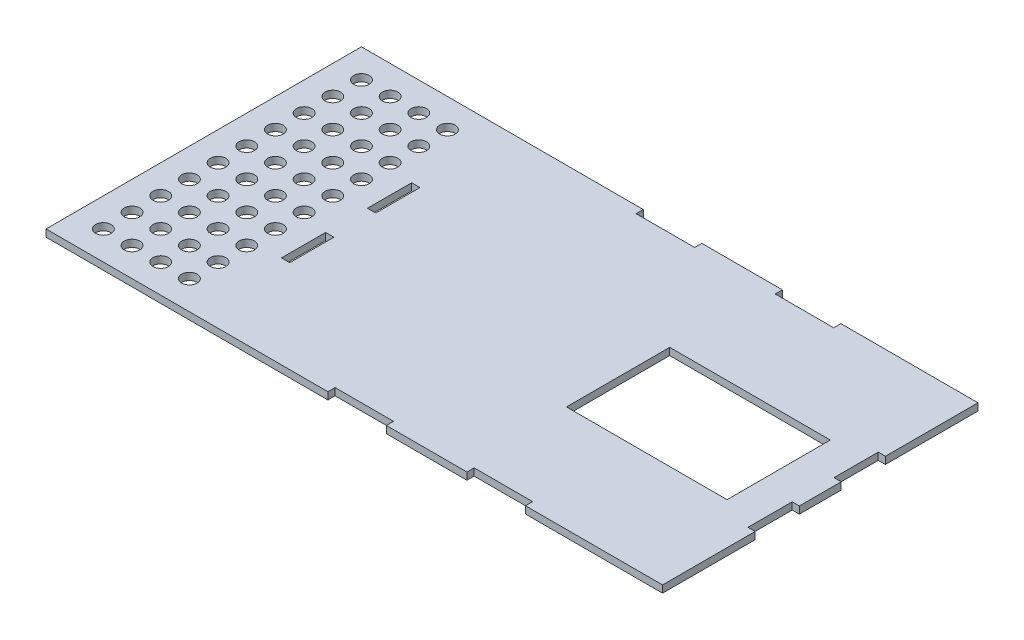
from build123d import *

# Parameters (mm, degrees)
SKETCH1_W           = 203.2
SKETCH1_H           = 133.35
BOSS_EXTRUDE1_DEPTH = 3.175
SKETCH3_W           = 35.687
SKETCH3_H           = 3.175
BOSS_EXTRUDE2_DEPTH = 3.175
SKETCH4_W           = 3.175
SKETCH4_H           = 18.542
BOSS_EXTRUDE3_DEPTH = 3.175
SKETCH5_W           = 63.5
SKETCH5_H           = 139.7
SKETCH5_R           = 3.429
BOSS_EXTRUDE4_DEPTH = 3.175
BOSS_EXTRUDE5_DEPTH = 3.175
SKETCH7_W           = 3.683
SKETCH7_H           = 19.558
CUT_EXTRUDE1_DEPTH  = 183.223979624
SKETCH8_W           = 71.12
SKETCH8_H           = 45.72
CUT_EXTRUDE4_DEPTH  = 183.223979624


with BuildPart() as part:
    # Sketch1 → Boss-Extrude1 (new body)
    with BuildSketch(Plane(origin=(0, 0, 0), x_dir=(1, 0, 0), z_dir=(0, 1, 0))):
        Rectangle(SKETCH1_W, SKETCH1_H)
    extrude(amount=BOSS_EXTRUDE1_DEPTH)

    # Sketch3 → Boss-Extrude2 (add)
    with BuildSketch(Plane(origin=(0, 3.175, 0), x_dir=(1, 0, 0), z_dir=(0, 1, 0))):
        with Locations((-61.2775, 68.2625)):
            Rectangle(SKETCH3_W, SKETCH3_H)
        with Locations((0.3175, 68.2625)):
            Rectangle(SKETCH3_W, SKETCH3_H)
        with Locations((61.9125, 68.2625)):
            Rectangle(SKETCH3_W, SKETCH3_H)
        with Locations((61.9125, -68.2625)):
            Rectangle(SKETCH3_W, SKETCH3_H)
        with Locations((0.3175, -68.2625)):
            Rectangle(SKETCH3_W, SKETCH3_H)
        with Locations((-61.2775, -68.2625)):
            Rectangle(SKETCH3_W, SKETCH3_H)
    extrude(amount=-BOSS_EXTRUDE2_DEPTH)

    # Sketch4 → Boss-Extrude3 (add)
    with BuildSketch(Plane(origin=(0, 3.175, 0), x_dir=(1, 0, 0), z_dir=(0, 1, 0))):
        with Locations((-103.1875, 38.1)):
            Rectangle(SKETCH4_W, SKETCH4_H)
        with Locations((-103.1875, 0)):
            Rectangle(SKETCH4_W, SKETCH4_H)
        with Locations((-103.1875, -38.1)):
            Rectangle(SKETCH4_W, SKETCH4_H)
        with Locations((103.1875, -38.1)):
            Rectangle(SKETCH4_W, SKETCH4_H)
        with Locations((103.1875, 0)):
            Rectangle(SKETCH4_W, SKETCH4_H)
        with Locations((103.1875, 38.1)):
            Rectangle(SKETCH4_W, SKETCH4_H)
    extrude(amount=-BOSS_EXTRUDE3_DEPTH)

    # Sketch5 → Boss-Extrude4 (add)
    with BuildSketch(Plane(origin=(0, 3.175, 0), x_dir=(1, 0, 0), z_dir=(0, 1, 0))):
        with Locations((-136.525, 0)):
            Rectangle(SKETCH5_W, SKETCH5_H)
        with Locations(Location((-117.475, 57.15, 0), (0, 0, 270))):
            Circle(SKETCH5_R, mode=Mode.SUBTRACT)
        with Locations(Location((-130.175, 57.15, 0), (0, 0, 270))):
            Circle(SKETCH5_R, mode=Mode.SUBTRACT)
        with Locations(Location((-142.875, 57.15, 0), (0, 0, 270))):
            Circle(SKETCH5_R, mode=Mode.SUBTRACT)
        with Locations(Location((-155.575, 57.15, 0), (0, 0, 270))):
            Circle(SKETCH5_R, mode=Mode.SUBTRACT)
        with Locations(Location((-130.175, 44.45, 0), (0, 0, 270))):
            Circle(SKETCH5_R, mode=Mode.SUBTRACT)
        with Locations(Location((-142.875, 44.45, 0), (0, 0, 270))):
            Circle(SKETCH5_R, mode=Mode.SUBTRACT)
        with Locations(Location((-155.575, 44.45, 0), (0, 0, 270))):
            Circle(SKETCH5_R, mode=Mode.SUBTRACT)
        with Locations(Location((-130.175, 31.75, 0), (0, 0, 270))):
            Circle(SKETCH5_R, mode=Mode.SUBTRACT)
        with Locations(Location((-142.875, 31.75, 0), (0, 0, 270))):
            Circle(SKETCH5_R, mode=Mode.SUBTRACT)
        with Locations(Location((-155.575, 31.75, 0), (0, 0, 270))):
            Circle(SKETCH5_R, mode=Mode.SUBTRACT)
        with Locations(Location((-130.175, 19.05, 0), (0, 0, 270))):
            Circle(SKETCH5_R, mode=Mode.SUBTRACT)
        with Locations(Location((-142.875, 19.05, 0), (0, 0, 270))):
            Circle(SKETCH5_R, mode=Mode.SUBTRACT)
        with Locations(Location((-155.575, 19.05, 0), (0, 0, 270))):
            Circle(SKETCH5_R, mode=Mode.SUBTRACT)
        with Locations(Location((-130.175, 6.35, 0), (0, 0, 270))):
            Circle(SKETCH5_R, mode=Mode.SUBTRACT)
        with Locations(Location((-142.875, 6.35, 0), (0, 0, 270))):
            Circle(SKETCH5_R, mode=Mode.SUBTRACT)
        with Locations(Location((-155.575, 6.35, 0), (0, 0, 270))):
            Circle(SKETCH5_R, mode=Mode.SUBTRACT)
        with Locations(Location((-130.175, -6.35, 0), (0, 0, 270))):
            Circle(SKETCH5_R, mode=Mode.SUBTRACT)
        with Locations(Location((-142.875, -6.35, 0), (0, 0, 270))):
            Circle(SKETCH5_R, mode=Mode.SUBTRACT)
        with Locations(Location((-155.575, -6.35, 0), (0, 0, 270))):
            Circle(SKETCH5_R, mode=Mode.SUBTRACT)
        with Locations(Location((-130.175, -19.05, 0), (0, 0, 270))):
            Circle(SKETCH5_R, mode=Mode.SUBTRACT)
        with Locations(Location((-142.875, -19.05, 0), (0, 0, 270))):
            Circle(SKETCH5_R, mode=Mode.SUBTRACT)
        with Locations(Location((-155.575, -19.05, 0), (0, 0, 270))):
            Circle(SKETCH5_R, mode=Mode.SUBTRACT)
        with Locations(Location((-130.175, -31.75, 0), (0, 0, 270))):
            Circle(SKETCH5_R, mode=Mode.SUBTRACT)
        with Locations(Location((-142.875, -31.75, 0), (0, 0, 270))):
            Circle(SKETCH5_R, mode=Mode.SUBTRACT)
        with Locations(Location((-155.575, -31.75, 0), (0, 0, 270))):
            Circle(SKETCH5_R, mode=Mode.SUBTRACT)
        with Locations(Location((-130.175, -44.45, 0), (0, 0, 270))):
            Circle(SKETCH5_R, mode=Mode.SUBTRACT)
        with Locations(Location((-142.875, -44.45, 0), (0, 0, 270))):
            Circle(SKETCH5_R, mode=Mode.SUBTRACT)
        with Locations(Location((-155.575, -44.45, 0), (0, 0, 270))):
            Circle(SKETCH5_R, mode=Mode.SUBTRACT)
        with Locations(Location((-130.175, -57.15, 0), (0, 0, 270))):
            Circle(SKETCH5_R, mode=Mode.SUBTRACT)
        with Locations(Location((-142.875, -57.15, 0), (0, 0, 270))):
            Circle(SKETCH5_R, mode=Mode.SUBTRACT)
        with Locations(Location((-155.575, -57.15, 0), (0, 0, 270))):
            Circle(SKETCH5_R, mode=Mode.SUBTRACT)
        with Locations(Location((-117.475, 44.45, 0), (0, 0, 270))):
            Circle(SKETCH5_R, mode=Mode.SUBTRACT)
        with Locations(Location((-117.475, 31.75, 0), (0, 0, 270))):
            Circle(SKETCH5_R, mode=Mode.SUBTRACT)
        with Locations(Location((-117.475, 19.05, 0), (0, 0, 270))):
            Circle(SKETCH5_R, mode=Mode.SUBTRACT)
        with Locations(Location((-117.475, 6.35, 0), (0, 0, 270))):
            Circle(SKETCH5_R, mode=Mode.SUBTRACT)
        with Locations(Location((-117.475, -6.35, 0), (0, 0, 270))):
            Circle(SKETCH5_R, mode=Mode.SUBTRACT)
        with Locations(Location((-117.475, -19.05, 0), (0, 0, 270))):
            Circle(SKETCH5_R, mode=Mode.SUBTRACT)
        with Locations(Location((-117.475, -31.75, 0), (0, 0, 270))):
            Circle(SKETCH5_R, mode=Mode.SUBTRACT)
        with Locations(Location((-117.475, -44.45, 0), (0, 0, 270))):
            Circle(SKETCH5_R, mode=Mode.SUBTRACT)
        with Locations(Location((-117.475, -57.15, 0), (0, 0, 270))):
            Circle(SKETCH5_R, mode=Mode.SUBTRACT)
    extrude(amount=-BOSS_EXTRUDE4_DEPTH)

    # Sketch6 → Boss-Extrude5 (add)
    with BuildSketch(Plane(origin=(0, 3.175, 0), x_dir=(1, 0, 0), z_dir=(0, 1, 0))):
        Polygon((-79.121, 66.675), (-79.121, 69.85), (-104.775, 69.85), (-104.775, 58.6105), (-104.775, 47.371), (-101.6, 47.371), (-101.6, 66.675), align=None)
        Polygon((-104.775, -47.371), (-104.775, -58.6105), (-104.775, -69.85), (-79.121, -69.85), (-79.121, -66.675), (-101.6, -66.675), (-101.6, -47.371), align=None)
        Polygon((79.121, -66.675), (79.121, -69.85), (104.775, -69.85), (104.775, -58.6105), (104.775, -47.371), (101.6, -47.371), (101.6, -66.675), align=None)
        Polygon((104.775, 47.371), (104.775, 58.6105), (104.775, 69.85), (79.121, 69.85), (79.121, 66.675), (101.6, 66.675), (101.6, 47.371), align=None)
    extrude(amount=-BOSS_EXTRUDE5_DEPTH)

    # Sketch7 → Cut-Extrude1 (cut, through all)
    with BuildSketch(Plane(origin=(0, 3.175, 0), x_dir=(1, 0, 0), z_dir=(0, 1, 0))):
        with Locations((-103.1875, 19.05)):
            Rectangle(SKETCH7_W, SKETCH7_H)
        with Locations((-103.1875, -19.05)):
            Rectangle(SKETCH7_W, SKETCH7_H)
    extrude(amount=-CUT_EXTRUDE1_DEPTH, mode=Mode.SUBTRACT)

    # Sketch8 → Cut-Extrude4 (cut, through all)
    with BuildSketch(Plane(origin=(0, 0, 0), x_dir=(1, 0, 0), z_dir=(0, 1, 0))):
        with Locations((50.8, 0)):
            Rectangle(SKETCH8_W, SKETCH8_H)
    extrude(amount=CUT_EXTRUDE4_DEPTH, mode=Mode.SUBTRACT)


solid = part.part
